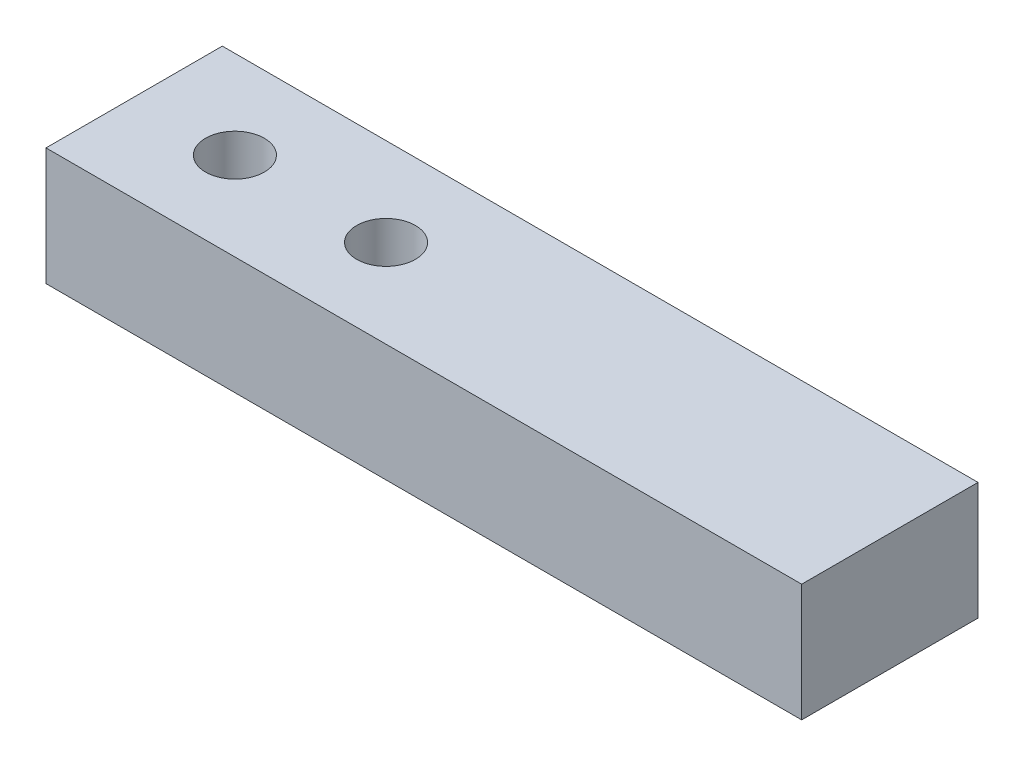
from build123d import *

# Parameters (mm, degrees)
SKETCH_1_W      = 180
SKETCH_1_H      = 42
SKETCH_1_R      = 7
EXTRUDE_1_DEPTH = 28


with BuildPart() as part:
    # 草图1 → 凸台-拉伸1 (new body)
    with BuildSketch(Plane(origin=(0, 0, 0), x_dir=(1, 0, 0), z_dir=(0, 1, 0))):
        Rectangle(SKETCH_1_W, SKETCH_1_H)
        with Locations(Location((-66, 0, 0), (0, 0, 270))):
            Circle(SKETCH_1_R, mode=Mode.SUBTRACT)
        with Locations(Location((-30, 0, 0), (0, 0, 270))):
            Circle(SKETCH_1_R, mode=Mode.SUBTRACT)
    extrude(amount=EXTRUDE_1_DEPTH)


solid = part.part
